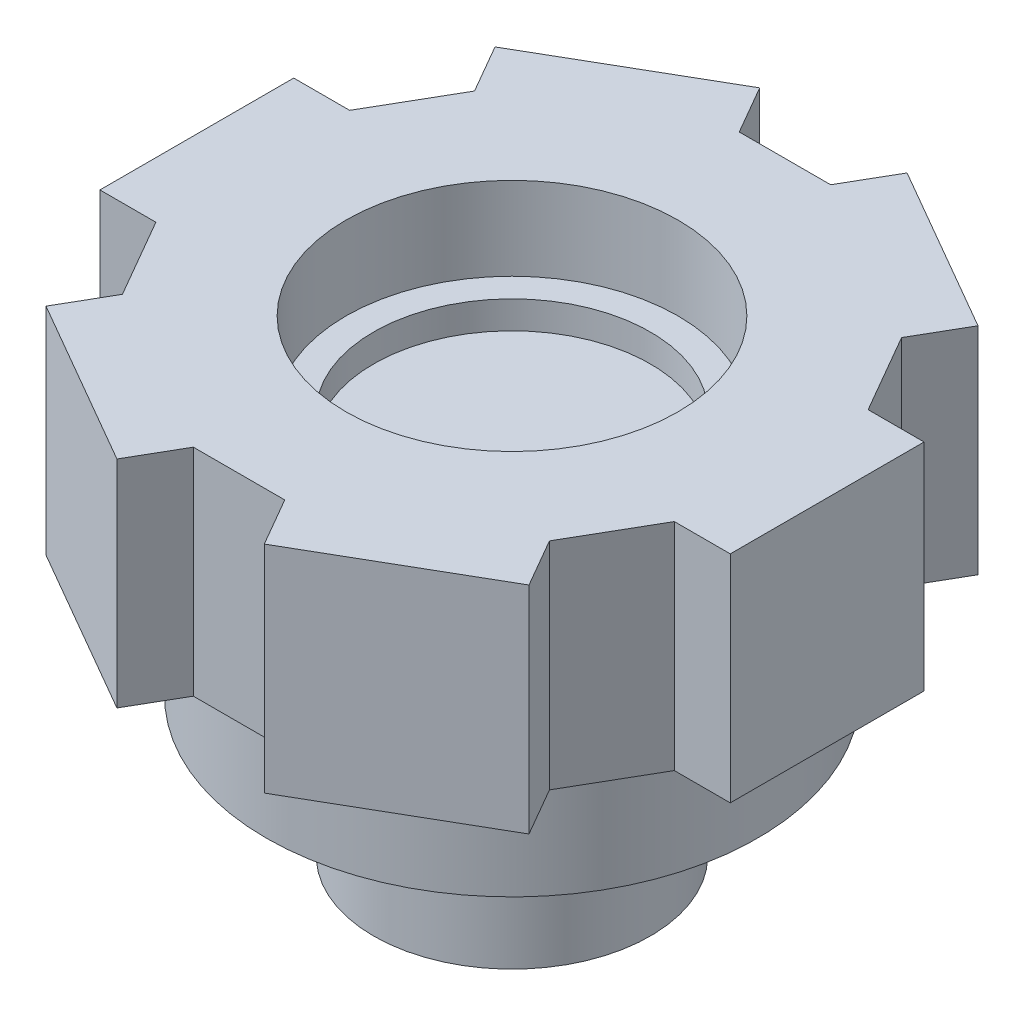
from build123d import *

# Parameters (mm, degrees)
SKETCH1_R           = 5
BOSS_EXTRUDE1_DEPTH = 5
SKETCH2_R           = 8.875
BOSS_EXTRUDE2_DEPTH = 4.11
BOSS_EXTRUDE3_DEPTH = 7.79
SKETCH4_R           = 6
CUT_EXTRUDE1_DEPTH  = 3
CUT_EXTRUDE2_START  = -1
SKETCH5_R           = 5
CUT_EXTRUDE2_DEPTH  = 1


with BuildPart() as part:
    # Sketch1 → Boss-Extrude1 (new body)
    with BuildSketch(Plane(origin=(0, 0, 0), x_dir=(1, 0, 0), z_dir=(0, 1, 0))):
        with Locations(Location((0, 0, 0), (0, 0, 270))):
            Circle(SKETCH1_R)
    extrude(amount=BOSS_EXTRUDE1_DEPTH)

    # Sketch2 → Boss-Extrude2 (add)
    with BuildSketch(Plane(origin=(0, 5, 0), x_dir=(1, 0, 0), z_dir=(0, 1, 0))):
        with Locations(Location((0, 0, 0), (0, 0, 270))):
            Circle(SKETCH2_R)
    extrude(amount=BOSS_EXTRUDE2_DEPTH)

    # Sketch3 → Boss-Extrude3 (add)
    with BuildSketch(Plane(origin=(0, 9.11, 0), x_dir=(1, 0, 0), z_dir=(0, 1, 0))):
        Polygon((9.364274058, 3.5), (11.385, 3.5), (11.385, -3.5), (9.364274058, -3.5), (7.713225942, -6.359699222), (8.723588913, -8.109699222), (2.661411087, -11.609699222), (1.651048116, -9.859699222), (-1.651048116, -9.859699222), (-2.661411087, -11.609699222), (-8.723588913, -8.109699222), (-7.713225942, -6.359699222), (-9.364274058, -3.5), (-11.385, -3.5), (-11.385, 3.5), (-9.364274058, 3.5), (-7.713225942, 6.359699222), (-8.723588913, 8.109699222), (-2.661411087, 11.609699222), (-1.651048116, 9.859699222), (1.651048116, 9.859699222), (2.661411087, 11.609699222), (8.723588913, 8.109699222), (7.713225942, 6.359699222), align=None)
    extrude(amount=BOSS_EXTRUDE3_DEPTH)

    # Sketch4 → Cut-Extrude1 (cut)
    with BuildSketch(Plane(origin=(0, 16.9, 0), x_dir=(1, 0, 0), z_dir=(0, 1, 0))):
        with Locations(Location((0, 0, 0), (0, 0, 270))):
            Circle(SKETCH4_R)
    extrude(amount=-CUT_EXTRUDE1_DEPTH, mode=Mode.SUBTRACT)

    # Sketch5 → Cut-Extrude2 (cut)
    with BuildSketch(Plane(origin=(0, 13.9, 0), x_dir=(1, 0, 0), z_dir=(0, 1, 0)).offset(CUT_EXTRUDE2_START)):
        with Locations(Location((0, 0, 0), (0, 0, 270))):
            Circle(SKETCH5_R)
    extrude(amount=CUT_EXTRUDE2_DEPTH, mode=Mode.SUBTRACT)


solid = part.part
